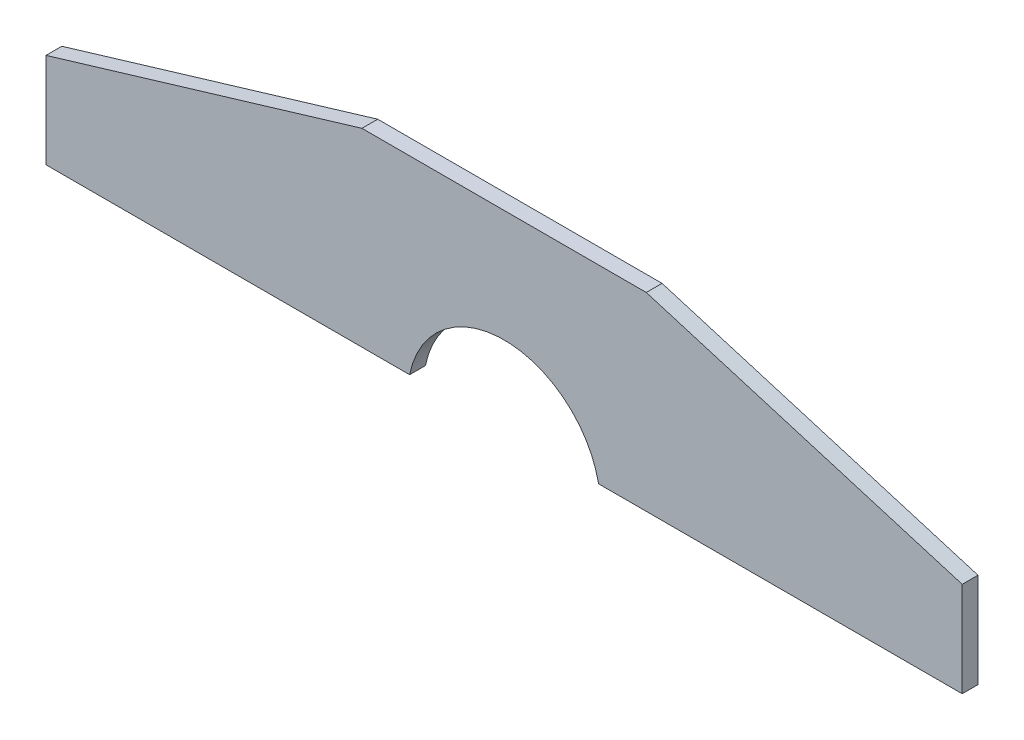
from build123d import *

# Parameters (mm, degrees)
BOSS_EXTRUDE1_DEPTH = 5


with BuildPart() as part:
    # Sketch1 → Boss-Extrude1 (new body)
    with BuildSketch(Plane.XY):
        with BuildLine():
            Line((-145, 36), (-45, 66))
            Line((-45, 66), (45, 66))
            Line((45, 66), (145, 36))
            Line((145, 36), (145, 6))
            Line((145, 6), (29.904013109, 6))
            ThreePointArc((29.904013109, 6), (0, 30.5), (-29.904013109, 6))
            Line((-29.904013109, 6), (-145, 6))
            Line((-145, 6), (-145, 36))
        make_face()
    extrude(amount=BOSS_EXTRUDE1_DEPTH)


solid = part.part
